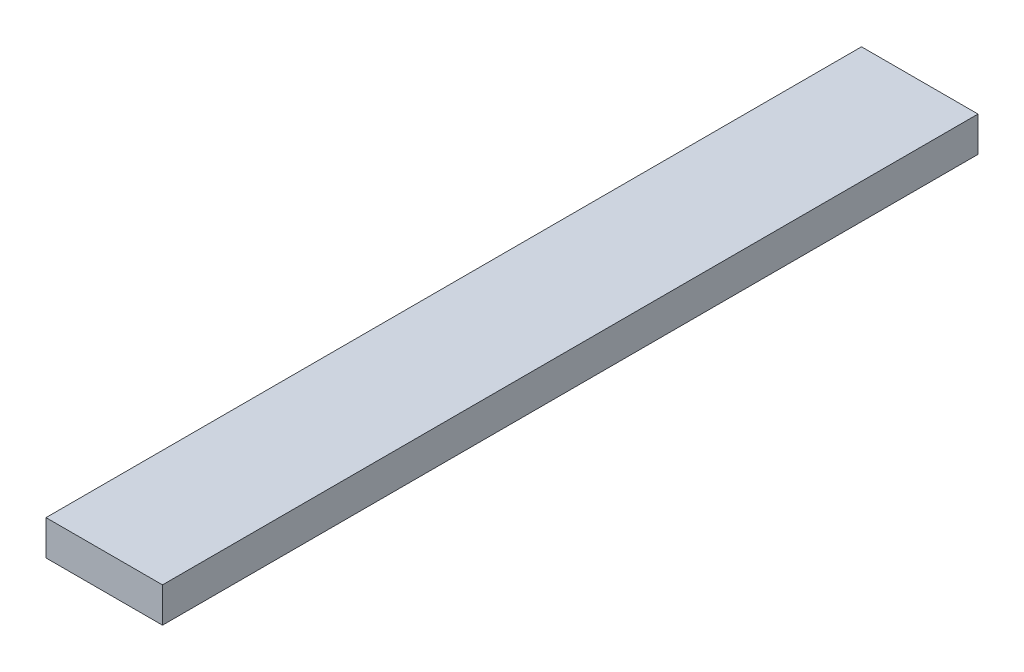
from build123d import *

# Parameters (mm, degrees)
SKETCH1_W           = 10
SKETCH1_H           = 70
BOSS_EXTRUDE1_DEPTH = 3


with BuildPart() as part:
    # Sketch1 → Boss-Extrude1 (new body)
    with BuildSketch(Plane.XZ.offset(16.3)):
        with Locations((-17.857482945, -22.246)):
            Rectangle(SKETCH1_W, SKETCH1_H)
    extrude(amount=-BOSS_EXTRUDE1_DEPTH)


solid = part.part
